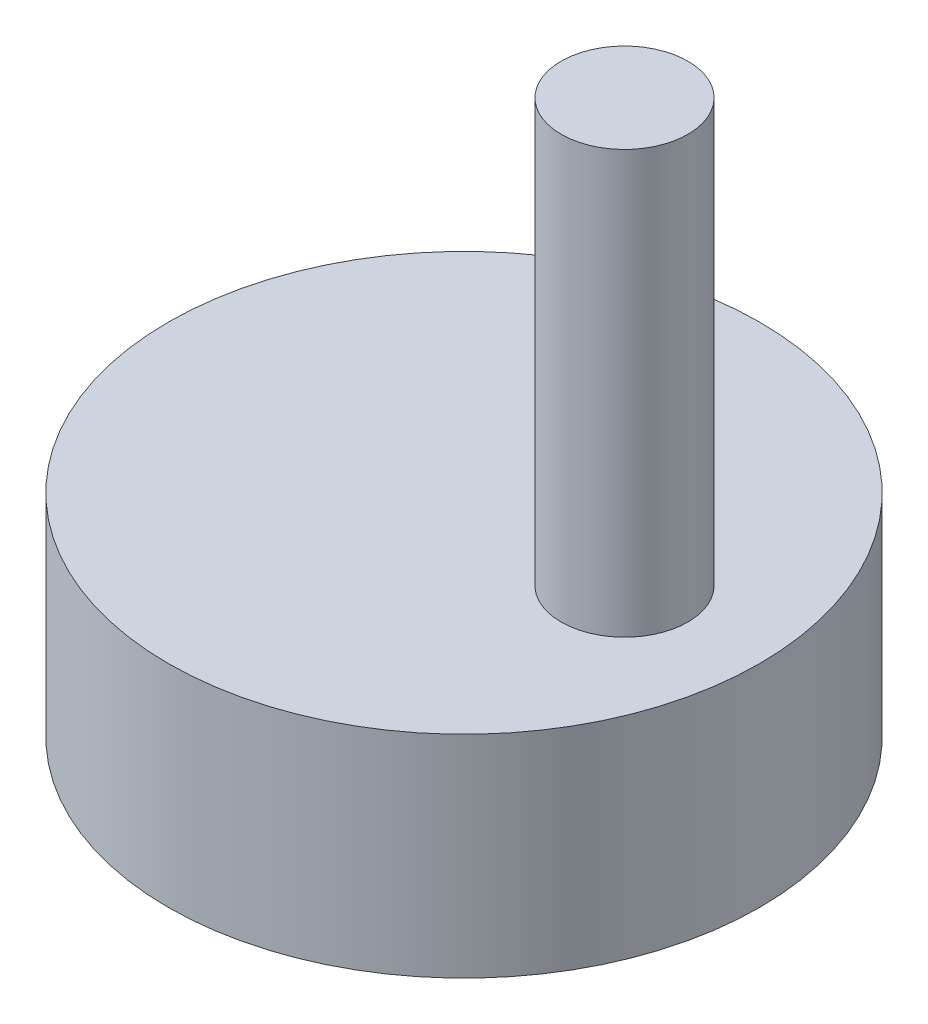
from build123d import *

# Parameters (mm, degrees)
SKETCH1_R           = 70
BOSS_EXTRUDE1_DEPTH = 50
SKETCH2_R           = 15
BOSS_EXTRUDE2_DEPTH = 100


with BuildPart() as part:
    # Sketch1 → Boss-Extrude1 (new body)
    with BuildSketch(Plane(origin=(0, 0, 0), x_dir=(1, 0, 0), z_dir=(0, 1, 0))):
        with Locations(Location((0, 0, 0), (0, 0, 270))):
            Circle(SKETCH1_R)
    extrude(amount=BOSS_EXTRUDE1_DEPTH)

    # Sketch2 → Boss-Extrude2 (add)
    with BuildSketch(Plane(origin=(0, 50, 0), x_dir=(1, 0, 0), z_dir=(0, 1, 0))):
        with Locations(Location((38, 0, 0), (0, 0, 270))):
            Circle(SKETCH2_R)
    extrude(amount=BOSS_EXTRUDE2_DEPTH)


solid = part.part
